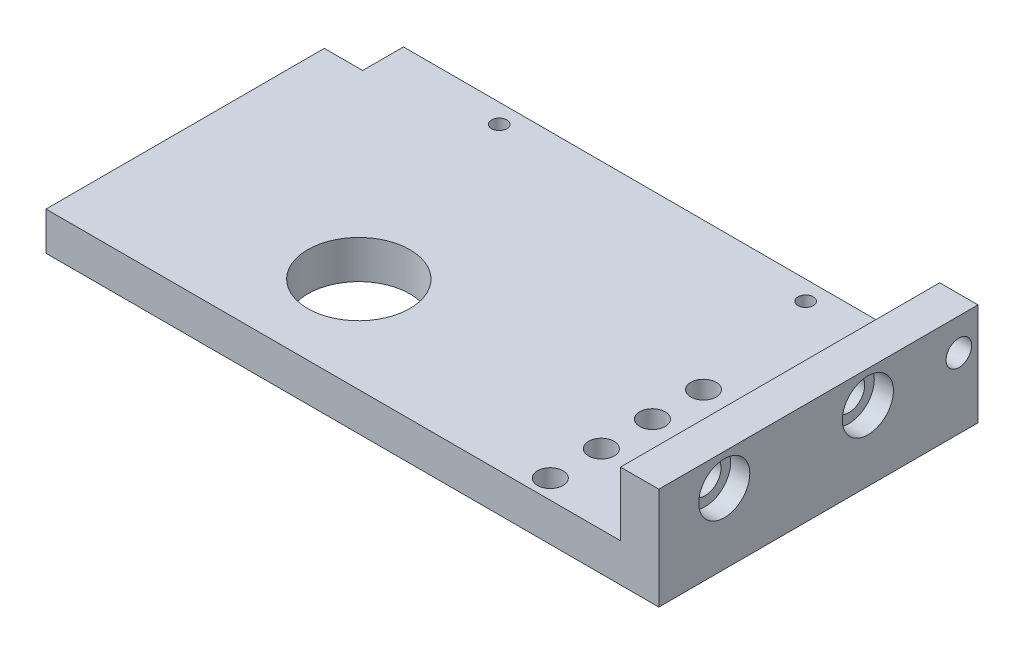
from build123d import *

# Parameters (mm, degrees)
SKETCH_1_W          = 42
SKETCH_1_H          = 3
EXTRUDE_1_DEPTH     = 3
SKETCH_2_W          = 25
SKETCH_2_H          = 8
EXTRUDE_2_DEPTH     = 3
SKETCH_3_R          = 1.25
CUT_EXTRUDE_1_DEPTH = 51.635955605
SKETCH_3_3_R        = 2
CUT_EXTRUDE_2_DEPTH = 1.5
SKETCH_4_R          = 0.6
CUT_EXTRUDE_3_DEPTH = 51.635955605
SKETCH_4_3_R        = 1
CUT_EXTRUDE_4_DEPTH = 1.5
SKETCH_5_W          = 3
SKETCH_5_H          = 0.2
CUT_EXTRUDE_5_DEPTH = 31.170349683
SKETCH_6_R          = 0.6
CUT_EXTRUDE_6_DEPTH = 31.170349683
SKETCH_6_3_R        = 1
CUT_EXTRUDE_7_DEPTH = 1.5
SKETCH_7_R          = 0.35
CUT_EXTRUDE_8_DEPTH = 3
SKETCH_8_R          = 4
SKETCH_8_R_2        = 1
CUT_EXTRUDE_9_DEPTH = 31.170349683


with BuildPart() as part:
    # 草图1 → 凸台-拉伸1 (new body)
    with BuildSketch(Plane(origin=(0, 0, 0), x_dir=(1, 0, 0), z_dir=(0, 1, 0))):
        Polygon((-22.5, 11), (-22.5, -11), (22.5, -11), (22.5, 11), (-19.5, 11), align=None)
        with Locations((1.5, 12.5)):
            Rectangle(SKETCH_1_W, SKETCH_1_H)
    extrude(amount=EXTRUDE_1_DEPTH)

    # 草图2 → 凸台-拉伸2 (add)
    with BuildSketch(Plane(origin=(22.5, 0, 0), x_dir=(0, 0, -1), z_dir=(1, 0, 0))):
        with Locations((1.5, 4)):
            Rectangle(SKETCH_2_W, SKETCH_2_H)
    extrude(amount=EXTRUDE_2_DEPTH)

    # 草图3 → 切除-拉伸1 (cut, through all)
    with BuildSketch(Plane(origin=(25.5, 0, 0), x_dir=(0, 0, -1), z_dir=(1, 0, 0))):
        with Locations((5.375, 5.500000041)):
            Circle(SKETCH_3_R)
        with Locations((-5.875, 5.500000041)):
            Circle(SKETCH_3_R)
    extrude(amount=-CUT_EXTRUDE_1_DEPTH, mode=Mode.SUBTRACT)

    # 草图3<3> → 切除-拉伸2 (cut)
    with BuildSketch(Plane(origin=(25.5, 0, 0), x_dir=(0, 0, -1), z_dir=(1, 0, 0))):
        with Locations((5.375, 5.500000041)):
            Circle(SKETCH_3_3_R)
        with Locations((-5.875, 5.500000041)):
            Circle(SKETCH_3_3_R)
    extrude(amount=-CUT_EXTRUDE_2_DEPTH, mode=Mode.SUBTRACT)

    # 草图4 → 切除-拉伸3 (cut, through all)
    with BuildSketch(Plane(origin=(25.5, 0, 0), x_dir=(0, 0, -1), z_dir=(1, 0, 0))):
        with Locations((12.5, 5.5)):
            Circle(SKETCH_4_R)
    extrude(amount=-CUT_EXTRUDE_3_DEPTH, mode=Mode.SUBTRACT)

    # 草图4<3> → 切除-拉伸4 (cut)
    with BuildSketch(Plane(origin=(25.5, 0, 0), x_dir=(0, 0, -1), z_dir=(1, 0, 0))):
        with Locations((12.5, 5.5)):
            Circle(SKETCH_4_3_R)
    extrude(amount=-CUT_EXTRUDE_4_DEPTH, mode=Mode.SUBTRACT)

    # 草图5 → 切除-拉伸5 (cut, through all)
    with BuildSketch(Plane.XZ):
        with Locations((-21, -10.9)):
            Rectangle(SKETCH_5_W, SKETCH_5_H)
    extrude(amount=-CUT_EXTRUDE_5_DEPTH, mode=Mode.SUBTRACT)

    # 草图6 → 切除-拉伸6 (cut, through all)
    with BuildSketch(Plane.XZ):
        with Locations((-10.5, -12.5)):
            Circle(SKETCH_6_R)
        with Locations((13.5, -12.5)):
            Circle(SKETCH_6_R)
    extrude(amount=-CUT_EXTRUDE_6_DEPTH, mode=Mode.SUBTRACT)

    # 草图6<3> → 切除-拉伸7 (cut)
    with BuildSketch(Plane.XZ):
        with Locations((-10.5, -12.5)):
            Circle(SKETCH_6_3_R)
        with Locations((13.5, -12.5)):
            Circle(SKETCH_6_3_R)
    extrude(amount=-CUT_EXTRUDE_7_DEPTH, mode=Mode.SUBTRACT)

    # 草图7 → 切除-拉伸8 (cut)
    with BuildSketch(Plane.XZ):
        with Locations((21, 4.75)):
            Circle(SKETCH_7_R)
        with Locations((21, -7.75)):
            Circle(SKETCH_7_R)
    extrude(amount=-CUT_EXTRUDE_8_DEPTH, mode=Mode.SUBTRACT)

    # 草图8 → 切除-拉伸9 (cut, through all)
    with BuildSketch(Plane.XZ):
        with Locations((-5.5, 3.5)):
            Circle(SKETCH_8_R)
        with Locations((15.5, 9.5)):
            Circle(SKETCH_8_R_2)
        with Locations((15.5, 5.5)):
            Circle(SKETCH_8_R_2)
        with Locations((15.5, 1.5)):
            Circle(SKETCH_8_R_2)
        with Locations((15.5, -2.5)):
            Circle(SKETCH_8_R_2)
    extrude(amount=-CUT_EXTRUDE_9_DEPTH, mode=Mode.SUBTRACT)


solid = part.part
